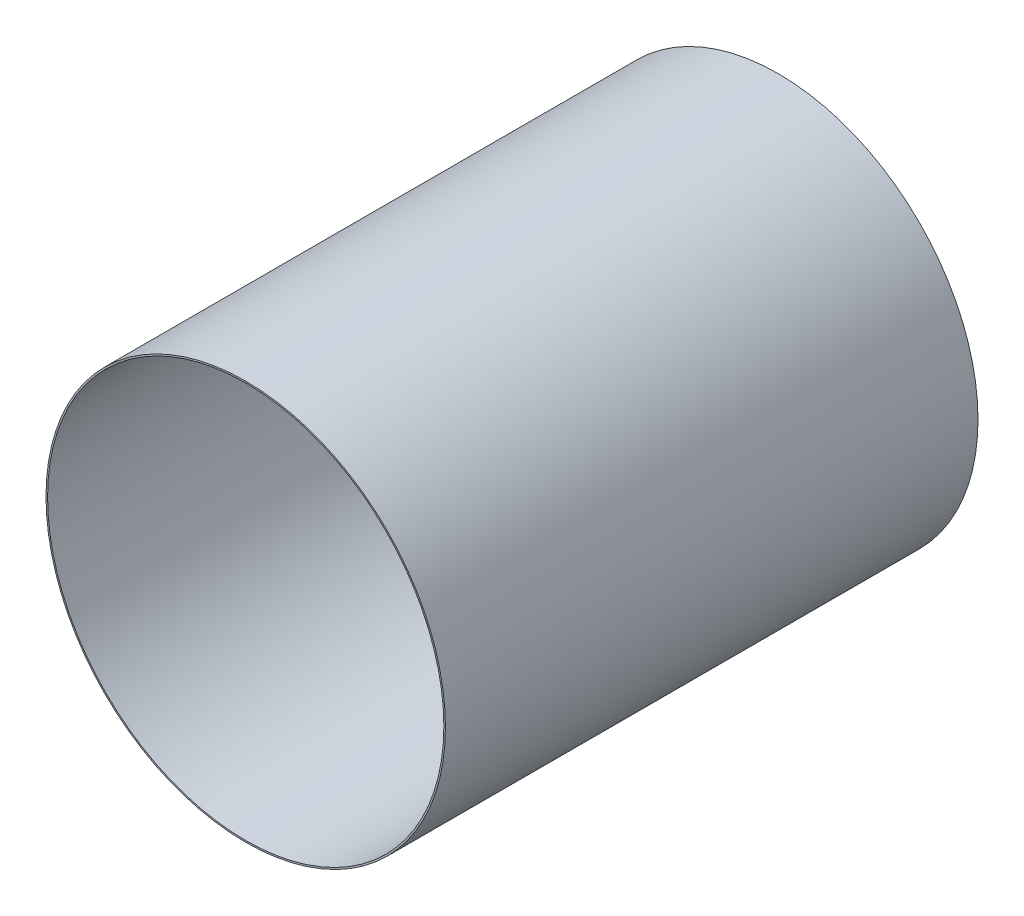
from build123d import *

# Parameters (mm, degrees)
SKETCH1_R           = 38.1
BOSS_EXTRUDE1_DEPTH = 101.6
SHELL1_T            = -0.3


with BuildPart() as part:
    # Sketch1 → Boss-Extrude1 (new body)
    with BuildSketch(Plane.XY):
        Circle(SKETCH1_R)
    extrude(amount=BOSS_EXTRUDE1_DEPTH)

    # Shell1
    shell1_openings = [part.faces().sort_by_distance(p)[0] for p in [
        (0, 0, 101.6),
    ]]
    offset(amount=SHELL1_T, openings=shell1_openings, kind=Kind.INTERSECTION)


solid = part.part
